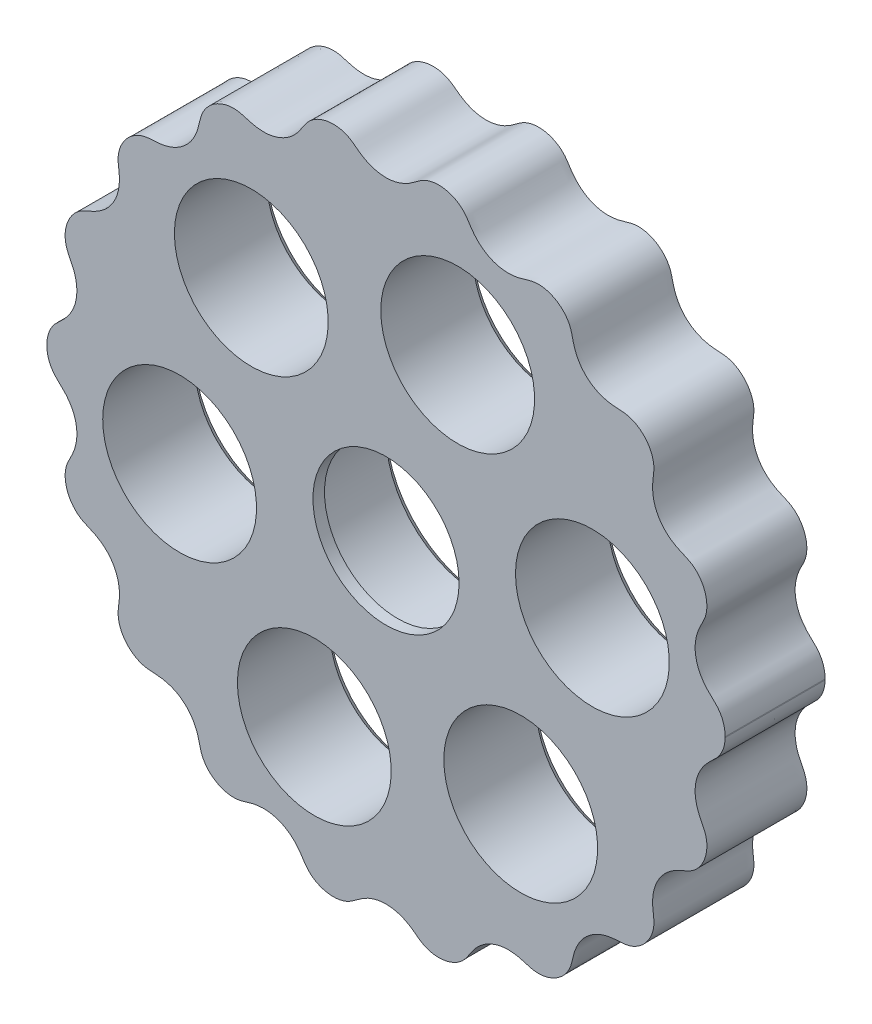
from build123d import *

# Parameters (mm, degrees)
SKETCH1_R           = 12
SKETCH1_R_2         = 10
BOSS_EXTRUDE1_DEPTH = 6.5
SKETCH2_R           = 12
SKETCH2_R_2         = 9.5
BOSS_EXTRUDE2_DEPTH = 1.5
CHAMFER1_SIZE       = 1
SKETCH3_R           = 2
CUT_EXTRUDE1_DEPTH  = 1


with BuildPart() as part:
    # Sketch1 → Boss-Extrude1 (new, symmetric)
    with BuildSketch(Plane.XY):
        with BuildLine():
            ThreePointArc((44.09846271, -0.120297451), (44.099615662, -0.060153637), (44.1, 0))
            add(Edge.make_bspline(
                [(44.1, 0), (44.1, 0.030582339), (44.099295019, 0.091713893), (44.096122609, 0.200230672), (44.087661895, 0.351561907), (44.071795075, 0.531247538), (44.04428375, 0.737073875), (44.006168898, 0.946542296), (43.957425433, 1.152666606), (43.900160222, 1.356431088), (43.812413105, 1.624775233), (43.675936475, 1.956123143), (43.470419463, 2.338777717), (43.197305058, 2.726793245), (42.902812043, 3.059105231), (42.58109647, 3.364199676), (42.254286202, 3.663345295), (41.856986683, 4.049625315), (41.447165826, 4.508756731), (41.051613906, 5.058485168), (40.618789304, 5.8583092), (40.269370645, 6.862026242), (40.137936345, 7.936917522), (40.240404209, 9.024104515), (40.482362435, 9.923761865), (40.724081469, 10.530300762), (40.97108831, 11.03289389), (41.229985791, 11.530543105), (41.474185326, 12.036906231), (41.691183802, 12.750565551), (41.764276023, 13.675936067), (41.623108512, 14.669544933), (41.234478952, 15.674127331), (40.678560364, 16.49565824), (40.090429028, 17.054351983), (39.552857002, 17.402836946), (39.128703091, 17.610539233), (38.781243017, 17.758160085), (38.345889239, 17.940123187), (37.689613694, 18.24208321), (36.853687075, 18.748045274), (35.965131924, 19.564248082), (35.225251456, 20.675396629), (34.804195973, 21.821798409), (34.658229928, 22.799492322), (34.655067852, 23.583725188), (34.701383157, 24.164920169), (34.758800744, 24.627621645), (34.818985589, 25.089923924), (34.84654015, 25.556170296), (34.818210152, 26.051946465), (34.722129932, 26.569072381), (34.505471113, 27.236301), (34.093967839, 28.010306986), (33.438898847, 28.796698359), (32.645298863, 29.376516626), (31.923687064, 29.700988923), (31.339668016, 29.85405597), (30.924684726, 29.917395871), (30.506301072, 29.945434514), (30.087663992, 29.963336051), (29.564799536, 29.997692993), (28.796136326, 30.096152538), (27.801145464, 30.364178651), (26.640226081, 30.964090634), (25.550143195, 31.954774727), (24.846621637, 33.053634631), (24.484382074, 34.021873538), (24.302699129, 34.749289614), (24.179926951, 35.300233441), (24.044423239, 35.849160709), (23.755805702, 36.54188671), (23.218171353, 37.305490718), (22.472071564, 37.98102807), (21.530439008, 38.5042834), (20.580299093, 38.779559581), (19.775815905, 38.833958978), (19.143182873, 38.760677392), (18.686610408, 38.650931511), (18.327313652, 38.542351942), (17.879640212, 38.402209028), (17.187886479, 38.209773042), (16.229461955, 38.054112071), (15.151073467, 38.09274439), (14.100089047, 38.356760976), (13.249031791, 38.739481125), (12.58434133, 39.158952743), (11.977677899, 39.67058215), (11.507578421, 40.1878044), (11.147724423, 40.672318816), (10.867598216, 41.097121697), (10.649089492, 41.440503163), (10.419531368, 41.77693594), (10.161637013, 42.09275822), (9.845224686, 42.408095955), (9.464094596, 42.709555526), (8.895457144, 43.056523218), (8.102126661, 43.373081146), (7.113647762, 43.551480417), (6.146992441, 43.490593114), (5.388787353, 43.281048452), (4.844298116, 43.02834904), (4.486128135, 42.814118135), (4.148316042, 42.569760821), (3.818107922, 42.315822042), (3.398954317, 42.006493157), (2.752963623, 41.586469498), (1.827013196, 41.147371788), (0.58682155, 40.856094169), (-0.825787213, 40.887809229), (-2.036911335, 41.226823143), (-2.922873312, 41.684787727), (-3.539086254, 42.106624435), (-3.938540017, 42.408260791), (-4.256782232, 42.651177885), (-4.586796747, 42.87862351), (-4.936564549, 43.074901023), (-5.473336654, 43.308552029), (-6.222362675, 43.500247903), (-7.156533426, 43.545260842), (-8.230808252, 43.344225225), (-9.141871481, 42.946112946), (-9.791949362, 42.477423805), (-10.230395156, 42.020653292), (-10.510662525, 41.647247429), (-10.715971773, 41.33556996), (-10.967061982, 40.942561621), (-11.368251004, 40.35233862), (-11.993282087, 39.617304076), (-12.97841885, 38.834516845), (-14.307237735, 38.242707883), (-15.622024308, 38.038627126), (-16.707839022, 38.119003307), (-17.500072709, 38.29427816), (-18.018301211, 38.444648049), (-18.429570271, 38.574994209), (-18.844473775, 38.694776108), (-19.268903788, 38.777332232), (-19.729598835, 38.815759727), (-20.221696228, 38.798965837), (-20.874245198, 38.696869462), (-21.66509694, 38.435025616), (-22.514847785, 37.953180038), (-23.200395547, 37.313874079), (-23.640684766, 36.700114689), (-23.897877079, 36.188908416), (-24.038798915, 35.822819516), (-24.14570416, 35.445592878), (-24.232416955, 35.063700515), (-24.340954715, 34.586246717), (-24.543215208, 33.839940537), (-24.947788797, 32.85750226), (-25.739597296, 31.72684512), (-26.819760535, 30.854338716), (-27.905465707, 30.341227289), (-28.868094308, 30.088202548), (-29.541958638, 29.996548127), (-30.108462772, 29.962476373), (-30.655020829, 29.938205731), (-31.201309824, 29.891812603), (-31.908031001, 29.72087577), (-32.723642871, 29.32967324), (-33.436966401, 28.77384955), (-34.02171822, 28.089347477), (-34.431915089, 27.387499691), (-34.694662263, 26.709230746), (-34.818436356, 26.099785622), (-34.844847688, 25.585996453), (-34.822940355, 25.179082946), (-34.791436358, 24.879005031), (-34.753038768, 24.579920299), (-34.716428646, 24.280538869), (-34.679148344, 23.905353418), (-34.654740012, 23.453338115), (-34.664444249, 22.924831089), (-34.75195722, 22.174555486), (-34.992777688, 21.246926527), (-35.49485932, 20.195629167), (-36.284987253, 19.233585586), (-37.112912437, 18.585709781), (-37.816422634, 18.186921293), (-38.333673471, 17.945504004), (-38.754550748, 17.769073044), (-39.175364364, 17.592154086), (-39.582378236, 17.383802375), (-39.986628463, 17.114698723), (-40.376004542, 16.779360681), (-40.834106283, 16.270323824), (-41.287004812, 15.551399504), (-41.637308827, 14.62812173), (-41.768371507, 13.595709672), (-41.684124506, 12.748436455), (-41.492248568, 12.108422891), (-41.295290007, 11.662675119), (-41.118291125, 11.315642771), (-40.894871832, 10.883113444), (-40.649341587, 10.358340876), (-40.418642377, 9.726303868), (-40.204358561, 8.795196487), (-40.145522417, 7.652328205), (-40.381120536, 6.331595163), (-40.965450241, 5.118884037), (-41.61712394, 4.290668733), (-42.161541191, 3.750146723), (-42.518756844, 3.420807878), (-42.802947684, 3.155593434), (-43.138835002, 2.803881527), (-43.535605258, 2.268096445), (-43.901990606, 1.501593586), (-44.130059664, 0.487327288), (-44.115280857, -0.499721202), (-43.934198242, -1.330483893), (-43.676038829, -1.966299666), (-43.423261334, -2.41490416), (-43.133783943, -2.806056266), (-42.821060018, -3.14086823), (-42.485157644, -3.451315525), (-42.149556174, -3.761932294), (-41.745906585, -4.167166853), (-41.221590771, -4.785017037), (-40.666695402, -5.680506796), (-40.257051826, -6.857452706), (-40.149173837, -8.017879378), (-40.243521673, -8.970889449), (-40.419776292, -9.70358782), (-40.592342067, -10.201915648), (-40.770344358, -10.616974673), (-40.933805627, -10.955757023), (-41.070477482, -11.223839478), (-41.208433622, -11.491182997), (-41.339912596, -11.761991738), (-41.498308259, -12.136437903), (-41.647421101, -12.627604975), (-41.737865857, -13.24140742), (-41.721603482, -13.966977122), (-41.573841835, -14.773142625), (-41.250138826, -15.629701143), (-40.749252092, -16.415207139), (-40.147205961, -17.010252187), (-39.594819817, -17.379378074), (-39.161311144, -17.596176795), (-38.805025373, -17.748345217), (-38.358110501, -17.934647133), (-37.663212048, -18.253297543), (-36.76838824, -18.802562479), (-35.939362408, -19.601736571), (-35.316158697, -20.558954833), (-34.950122541, -21.436055872), (-34.754042331, -22.173538439), (-34.656088924, -22.935545613), (-34.653931862, -23.61067391), (-34.703719863, -24.189996698), (-34.765383694, -24.674575683), (-34.81397009, -25.062408262), (-34.841540871, -25.452665597), (-34.833181142, -25.844048896), (-34.764965034, -26.410975943), (-34.55998969, -27.136274054), (-34.130106215, -27.97665388), (-33.486600338, -28.726292496), (-32.817113708, -29.248044889), (-32.215634741, -29.570550395), (-31.737327038, -29.753738779), (-31.267500658, -29.870036943), (-30.815471687, -29.928441969), (-30.361030791, -29.951506086), (-29.906667319, -29.972758144), (-29.339776297, -30.021083845), (-28.544466187, -30.151723632), (-27.546704683, -30.471434918), (-26.478173427, -31.095048646), (-25.647320317, -31.898584035), (-25.10239482, -32.674476355), (-24.761365603, -33.336069955), (-24.568767068, -33.819988104), (-24.43437926, -34.245337494), (-24.339301092, -34.604486443), (-24.270753084, -34.893678816), (-24.205608209, -35.183590943), (-24.136880384, -35.472757033), (-24.050811004, -35.77755897), (-23.936799286, -36.09387039), (-23.748054056, -36.501876609), (-23.449424294, -36.980019677), (-23.022208126, -37.481293945), (-22.37190494, -38.029035732), (-21.543996884, -38.495425322), (-20.716802817, -38.750694736), (-19.945512169, -38.825169103), (-19.360009153, -38.787513155), (-18.963533832, -38.721380529), (-18.575040389, -38.619360483), (-18.192152994, -38.499434578), (-17.712447107, -38.352692809), (-16.987140235, -38.168064143), (-15.995396696, -38.043289356), (-14.740360378, -38.14351655), (-13.403770201, -38.60204859), (-12.341500387, -39.303110651), (-11.625334349, -40.033023765), (-11.164189776, -40.648291672), (-10.877480388, -41.081769904), (-10.654112339, -41.432376754), (-10.362293943, -41.862579814), (-9.898957469, -42.39380659), (-9.186877311, -42.932069056), (-8.203652248, -43.360186881), (-7.073425779, -43.552918299), (-6.114758961, -43.484141936), (-5.371303854, -43.274035793), (-4.83794451, -43.024530718), (-4.487448407, -42.814603777), (-4.156442995, -42.575830484), (-3.833097062, -42.327331889), (-3.423271009, -42.023841625), (-2.753716617, -41.584000957), (-1.761177835, -41.114046368), (-0.442541783, -40.830777832), (1.04034648, -40.920254359), (2.252417482, -41.317610326), (3.09650233, -41.792742644), (3.678670512, -42.210207914), (4.050490435, -42.494481264), (4.35060621, -42.718566731), (4.741935769, -42.976220074), (5.310916554, -43.259191601), (6.084178406, -43.480922288), (7.077933685, -43.546124783), (8.156476131, -43.370102225), (9.018462764, -43.011157465), (9.656016991, -42.578729122), (10.080782748, -42.178919727), (10.342853812, -41.877186594), (10.575683914, -41.552671326), (10.791284769, -41.216992947), (11.061971873, -40.798077323), (11.493264018, -40.191749402), (12.163295218, -39.457960445), (13.179415143, -38.7205455), (14.492583144, -38.199444452), (15.758641774, -38.041292413), (16.782918125, -38.132591437), (17.536861339, -38.304275448), (18.038653926, -38.451113119), (18.437255387, -38.577263602), (18.839333512, -38.692964935), (19.250287676, -38.774080539), (19.706760182, -38.815154541), (20.204477302, -38.801337083), (20.87838832, -38.698153021), (21.705590007, -38.420535352), (22.463704881, -37.977676038), (23.114687414, -37.389734315), (23.546273059, -36.834785401), (23.812890959, -36.3801295), (24.008221759, -35.922420332), (24.140860623, -35.473592642), (24.242260888, -35.017553876), (24.347195828, -34.56224792), (24.50376963, -33.999345112), (24.777370507, -33.262603258), (25.252616649, -32.39340942), (26.044466378, -31.462244735), (27.12250307, -30.675469892), (28.236854798, -30.216832645), (29.193640074, -30.030337342), (29.912043171, -29.972421383), (30.382335346, -29.950597318), (30.75847886, -29.930367614), (31.226932083, -29.879153412), (31.849447973, -29.734048413), (32.590755945, -29.409273353), (33.392350293, -28.826733082), (34.100018355, -28.014638248), (34.571598965, -27.127481886), (34.817960044, -26.23031971), (34.855943096, -25.483616367), (34.798003056, -24.923242604), (34.725020225, -24.365642928), (34.645359033, -23.622859719), (34.649919195, -22.592823235), (34.924428859, -21.334088241), (35.584058713, -20.049835251), (36.443231319, -19.087381218), (37.268728118, -18.484675749), (37.961490591, -18.114609028), (38.466138814, -17.888697896), (38.874728958, -17.719891835), (39.280230775, -17.542929398), (39.669161606, -17.330705101), (40.056946046, -17.059046934), (40.432076281, -16.722445885), (40.875433593, -16.212475938), (41.322489458, -15.479264938), (41.615933906, -14.664126065), (41.73887756, -13.804953845), (41.716607993, -13.106158322), (41.632371772, -12.588810662), (41.492050776, -12.114232308), (41.309224007, -11.686155096), (41.095874956, -11.273392968), (40.883820488, -10.859972012), (40.640863665, -10.332170587), (40.373573773, -9.597772207), (40.17218546, -8.633470378), (40.168487478, -7.413916715), (40.475763876, -6.114266785), (41.026608021, -5.038111668), (41.638043945, -4.271071158), (42.151964065, -3.759496054), (42.499799474, -3.438109958), (42.777261114, -3.180133336), (43.107305972, -2.839919436), (43.41761136, -2.433194203), (43.652917128, -2.012034456), (43.824244209, -1.593942172), (43.923825344, -1.282354037), (43.98889457, -1.028195172), (44.032990151, -0.803371317), (44.061583152, -0.612612736), (44.079561938, -0.444083336), (44.090428215, -0.304041932), (44.095681807, -0.205349469), (44.097737985, -0.14864679), (44.09846271, -0.120297451)],
                knots=[0.066570873, 0.066570873, 0.066570873, 0.066570873, 0.066570873, 0.066980916, 0.067390959, 0.067801002, 0.068211045, 0.069031131, 0.069851217, 0.07026126, 0.070671303, 0.071491388, 0.07313156, 0.074419241, 0.075706922, 0.076994603, 0.078282284, 0.079569965, 0.080857646, 0.083433008, 0.085425324, 0.08741764, 0.091402271, 0.095714799, 0.097871063, 0.100027327, 0.102201894, 0.103289177, 0.104376461, 0.106551028, 0.108725595, 0.111901818, 0.115078042, 0.11810879, 0.121139538, 0.123333277, 0.124430146, 0.125527015, 0.126623885, 0.127720754, 0.129914493, 0.133920534, 0.137926576, 0.141605194, 0.145283812, 0.147993221, 0.149347925, 0.150702629, 0.152057334, 0.153412038, 0.154766742, 0.156121447, 0.157814915, 0.159508384, 0.162895322, 0.166245109, 0.169594896, 0.170812693, 0.172030489, 0.173248286, 0.174466083, 0.17568388, 0.176901677, 0.17933727, 0.183463281, 0.187589293, 0.191925911, 0.19626253, 0.198450219, 0.199544064, 0.200637908, 0.202825598, 0.205013287, 0.208207964, 0.211402641, 0.214415516, 0.217428391, 0.219609374, 0.220699866, 0.221790357, 0.222880849, 0.22397134, 0.226152324, 0.230133335, 0.234114346, 0.236390692, 0.238667038, 0.240943384, 0.24321973, 0.245585308, 0.246768097, 0.247950887, 0.249133676, 0.250316465, 0.251499254, 0.252682043, 0.254316498, 0.255950954, 0.259219864, 0.26255088, 0.265881896, 0.267092585, 0.268303275, 0.269513964, 0.270724654, 0.271935343, 0.273146033, 0.275567412, 0.279671716, 0.28377602, 0.287796029, 0.291816039, 0.294143003, 0.295306485, 0.296469967, 0.297633449, 0.298796931, 0.299960413, 0.301123895, 0.304425603, 0.307727312, 0.310722301, 0.313717291, 0.315885698, 0.316969902, 0.318054105, 0.319138309, 0.320222512, 0.322390919, 0.326346802, 0.330302685, 0.334706574, 0.339110463, 0.341618419, 0.342872397, 0.344126375, 0.345380353, 0.346634331, 0.347888309, 0.349142287, 0.35074281, 0.352343333, 0.355544379, 0.358770032, 0.361995685, 0.363133751, 0.364271816, 0.365409882, 0.366547948, 0.367686013, 0.368824079, 0.37110021, 0.375531317, 0.379962424, 0.384669464, 0.387022985, 0.389376505, 0.391497023, 0.392557282, 0.393617541, 0.39573806, 0.397858578, 0.400955073, 0.404051568, 0.406155954, 0.40826034, 0.410364726, 0.412469112, 0.413345475, 0.414221839, 0.415098202, 0.415974566, 0.41685093, 0.417727293, 0.41948002, 0.421232748, 0.422985475, 0.426490929, 0.430570083, 0.434649237, 0.437301685, 0.438627909, 0.439954133, 0.441280356, 0.44260658, 0.443932804, 0.445259028, 0.446911395, 0.448563762, 0.451868496, 0.455075717, 0.458282939, 0.460546531, 0.461678327, 0.462810123, 0.463941918, 0.465073714, 0.467337306, 0.469540092, 0.471742878, 0.47614845, 0.480544266, 0.484940083, 0.487198922, 0.488328342, 0.489457762, 0.490587182, 0.491716602, 0.493975441, 0.497175621, 0.5003758, 0.503687282, 0.505343023, 0.506998763, 0.50832765, 0.509656537, 0.510985424, 0.51231431, 0.513643197, 0.514972084, 0.517629857, 0.521717381, 0.525804906, 0.529302233, 0.531050896, 0.53279956, 0.534548223, 0.535422555, 0.536296887, 0.537171218, 0.53804555, 0.538919882, 0.539794214, 0.541893842, 0.543993471, 0.5460931, 0.548192729, 0.551381438, 0.554570148, 0.556821293, 0.557946865, 0.559072438, 0.560198011, 0.561323583, 0.563574729, 0.567954651, 0.572334572, 0.57454527, 0.576755967, 0.578966665, 0.581177362, 0.583448707, 0.58458438, 0.585720053, 0.586855726, 0.587991398, 0.589127071, 0.590262744, 0.593481387, 0.59670003, 0.599993743, 0.601640599, 0.603287456, 0.604609357, 0.605931259, 0.60725316, 0.608575062, 0.609896963, 0.611218864, 0.613862667, 0.617928144, 0.62199362, 0.62544775, 0.627174814, 0.628901879, 0.630628943, 0.631492476, 0.632356008, 0.63321954, 0.634083073, 0.634946605, 0.635810137, 0.636898505, 0.637986872, 0.640163606, 0.64234034, 0.644517075, 0.647825992, 0.651134909, 0.65230094, 0.653466972, 0.654633004, 0.655799036, 0.656965067, 0.658131099, 0.660463162, 0.664492037, 0.668520911, 0.672616957, 0.676713003, 0.679128965, 0.680336947, 0.681544928, 0.68275291, 0.683960891, 0.686376854, 0.68970069, 0.693024526, 0.696300307, 0.699576088, 0.700761305, 0.701946522, 0.703131739, 0.704316956, 0.705502173, 0.70668739, 0.709057825, 0.713619923, 0.718182022, 0.722153474, 0.726124927, 0.728301098, 0.729389184, 0.73047727, 0.731565356, 0.732653441, 0.734829613, 0.737835677, 0.740841741, 0.744131712, 0.747421683, 0.748581038, 0.749740394, 0.75089975, 0.752059105, 0.753218461, 0.754377817, 0.756696528, 0.7607021, 0.764707672, 0.768825411, 0.77294315, 0.775373332, 0.776588423, 0.777803513, 0.779018604, 0.780233695, 0.781448785, 0.782663876, 0.784335202, 0.786006528, 0.78934918, 0.792743127, 0.794440101, 0.796137075, 0.797494633, 0.798852192, 0.80020975, 0.801567309, 0.802924867, 0.804282426, 0.806997543, 0.810683815, 0.814370087, 0.818366607, 0.822363127, 0.824551987, 0.825646417, 0.826740847, 0.827835278, 0.828929708, 0.831118568, 0.834142511, 0.837166454, 0.84034971, 0.843532966, 0.845712512, 0.847892057, 0.84898183, 0.850071603, 0.852251149, 0.856572869, 0.860894589, 0.864871123, 0.868847657, 0.871417421, 0.872702303, 0.873987185, 0.875272067, 0.876556949, 0.877841831, 0.879126713, 0.880763442, 0.882400171, 0.885673629, 0.889049125, 0.890736874, 0.892424622, 0.893774692, 0.895124762, 0.896474832, 0.897824901, 0.899174971, 0.900525041, 0.90322518, 0.906891318, 0.910557455, 0.914578945, 0.918600435, 0.920802146, 0.921903002, 0.923003857, 0.924104713, 0.925205569, 0.92740728, 0.92892819, 0.929688644, 0.930449099, 0.931209554, 0.931970009, 0.932350236, 0.932730464, 0.933110691, 0.933490919, 0.933490919, 0.933490919, 0.933490919, 0.933490919], degree=4))
        make_face()
        with Locations(Location((0, 0, 0), (0, 0, 180))):
            Circle(SKETCH1_R, mode=Mode.SUBTRACT)
        with Locations(Location((26.83601127, 4.731912841, 0), (0, 0, 180))):
            Circle(SKETCH1_R_2, mode=Mode.SUBTRACT)
        with Locations(Location((17.515962364, -20.874711075, 0), (0, 0, 180))):
            Circle(SKETCH1_R_2, mode=Mode.SUBTRACT)
        with Locations(Location((-9.320048906, -25.606623916, 0), (0, 0, 180))):
            Circle(SKETCH1_R_2, mode=Mode.SUBTRACT)
        with Locations(Location((-26.83601127, -4.731912841, 0), (0, 0, 180))):
            Circle(SKETCH1_R_2, mode=Mode.SUBTRACT)
        with Locations(Location((-17.515962364, 20.874711075, 0), (0, 0, 180))):
            Circle(SKETCH1_R_2, mode=Mode.SUBTRACT)
        with Locations(Location((9.320048906, 25.606623916, 0), (0, 0, 180))):
            Circle(SKETCH1_R_2, mode=Mode.SUBTRACT)
    extrude(amount=BOSS_EXTRUDE1_DEPTH, both=True)

    # Sketch2 → Boss-Extrude2 (add)
    with BuildSketch(Plane.XY.offset(6.5)):
        with Locations(Location((0, 0, 0), (0, 0, 180))):
            Circle(SKETCH2_R)
        Circle(SKETCH2_R_2, mode=Mode.SUBTRACT)
    extrude(amount=-BOSS_EXTRUDE2_DEPTH)

    # Chamfer1
    chamfer1_edges = [part.edges().sort_by_distance(p)[0] for p in [
        (36.83601127, 4.731912841, -6.5),
        (27.515962364, -20.874711075, -6.5),
        (0.679951094, -25.606623916, -6.5),
        (-16.83601127, -4.731912841, -6.5),
        (-7.515962364, 20.874711075, -6.5),
        (19.320048906, 25.606623916, -6.5),
        (12, 0, -6.5),
    ]]
    chamfer(chamfer1_edges, length=CHAMFER1_SIZE)

    # Sketch3 → Cut-Extrude1 (cut)
    with BuildSketch(Plane(origin=(0, 0, -6.5), x_dir=(-1, 0, 0), z_dir=(0, 0, -1))):
        with Locations((32.803569929, 11.855368678)):
            Circle(SKETCH3_R)
    extrude(amount=-CUT_EXTRUDE1_DEPTH, mode=Mode.SUBTRACT)


solid = part.part
